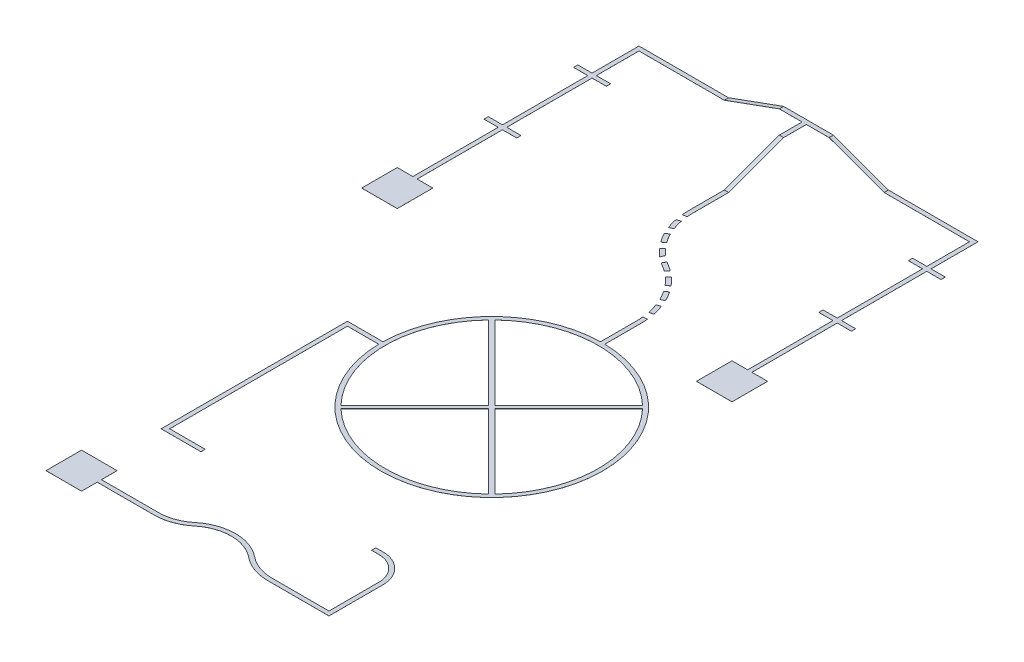
from build123d import *

# Parameters (mm, degrees)
BOSS_EXTRUDE1_DEPTH   = 0.2
BOSS_EXTRUDE3_DEPTH   = 0.2
BOSS_EXTRUDE4_DEPTH   = 0.2
SKETCH6_W             = 30
SKETCH6_H             = 412
BOSS_EXTRUDE5_DEPTH   = 0.2
BOSS_EXTRUDE6_DEPTH   = 0.2
SKETCH8_W             = 30
SKETCH8_H             = 412
BOSS_EXTRUDE7_DEPTH   = 0.2
SKETCH9_W             = 30
SKETCH9_H             = 412
BOSS_EXTRUDE8_DEPTH   = 0.2
BOSS_EXTRUDE9_DEPTH   = 0.2
BOSS_EXTRUDE9_2_DEPTH = 0.2


with BuildPart() as part:
    # Sketch2 → Boss-Extrude1 (new body)
    with BuildSketch(Plane(origin=(0, 0, 0), x_dir=(1, 0, 0), z_dir=(0, 1, 0))):
        with BuildLine():
            Line((250, 140), (650, 140))
            ThreePointArc((650, 140), (751.163325884, 157.571280681), (840.476190476, 208.226790026))
            ThreePointArc((840.476190476, 208.226790026), (1050, 283.276259054), (1259.523809524, 208.226790026))
            ThreePointArc((1259.523809524, 208.226790026), (1348.836674116, 157.571280681), (1450, 140))
            Line((1450, 140), (1850, 140))
            Line((1850, 140), (1850, 490))
            ThreePointArc((1850, 490), (1800.208152802, 610.208152802), (1680, 660))
            Line((1680, 660), (1630, 660))
            Line((1630, 660), (1630, 690))
            Line((1630, 690), (1680, 690))
            ThreePointArc((1680, 690), (1821.421356237, 631.421356237), (1880, 490))
            Line((1880, 490), (1880, 110))
            Line((1880, 110), (1850, 110))
            Line((1850, 110), (1450, 110))
            ThreePointArc((1450, 110), (1338.720341528, 129.328408749), (1240.476190476, 185.049469029))
            ThreePointArc((1240.476190476, 185.049469029), (1050, 253.276259054), (859.523809524, 185.049469029))
            ThreePointArc((859.523809524, 185.049469029), (761.279658472, 129.328408749), (650, 110))
            Line((650, 110), (250, 110))
            Line((250, 110), (250, 0))
            Line((250, 0), (0, 0))
            Line((0, 0), (0, 250))
            Line((0, 250), (250, 250))
            Line((250, 250), (250, 140))
        make_face()
    extrude(amount=BOSS_EXTRUDE1_DEPTH)


with BuildPart() as body_2:
    # Sketch3 → Boss-Extrude3 (new body)
    with BuildSketch(Plane(origin=(0, 0, 0), x_dir=(1, 0, 0), z_dir=(0, 1, 0))):
        with BuildLine():
            Line((150, 660), (430, 660))
            Line((430, 660), (430, 690))
            Line((430, 690), (180, 690))
            Line((180, 690), (180, 1940))
            Line((180, 1940), (400, 1940))
            ThreePointArc((400, 1940), (1731.399045219, 1403.456710674), (1194.855755893, 2734.855755893))
            Line((1194.855755893, 2734.855755893), (1194.855755893, 2834.855755893))
            Line((1194.855755893, 2834.855755893), (1164.855755893, 2834.855755893))
            Line((1164.855755893, 2834.855755893), (1164.855755893, 2734.855755893))
            ThreePointArc((1164.855755893, 2734.855755893), (628.312466568, 2506.543289326), (400, 1970))
            Line((400, 1970), (150, 1970))
            Line((150, 1970), (150, 660))
        make_face()
        with BuildLine():
            Line((660.238348347, 1414.169389018), (1179.855755893, 1933.786796564))
            Line((1179.855755893, 1933.786796564), (1699.47316344, 1414.169389018))
            ThreePointArc((1699.47316344, 1414.169389018), (1179.855755893, 1205), (660.238348347, 1414.169389018))
        make_face(mode=Mode.SUBTRACT)
        with BuildLine():
            ThreePointArc((639.025144911, 1435.382592454), (429.855755893, 1955), (639.025144912, 2474.617407546))
            Line((639.025144912, 2474.617407546), (1158.642552458, 1955))
            Line((1158.642552458, 1955), (639.025144911, 1435.382592454))
        make_face(mode=Mode.SUBTRACT)
        with BuildLine():
            Line((1720.686366875, 1435.382592454), (1201.068959329, 1955))
            Line((1201.068959329, 1955), (1720.686366875, 2474.617407546))
            ThreePointArc((1720.686366875, 2474.617407546), (1929.855755893, 1955), (1720.686366875, 1435.382592454))
        make_face(mode=Mode.SUBTRACT)
        with BuildLine():
            Line((1699.47316344, 2495.830610982), (1179.855755893, 1976.213203436))
            Line((1179.855755893, 1976.213203436), (660.238348347, 2495.830610982))
            ThreePointArc((660.238348347, 2495.830610982), (1179.855755893, 2705), (1699.47316344, 2495.830610982))
        make_face(mode=Mode.SUBTRACT)
    extrude(amount=BOSS_EXTRUDE3_DEPTH)

    # Sketch5 → Boss-Extrude4 (add)
    with BuildSketch(Plane(origin=(0, 0, 0), x_dir=(1, 0, 0), z_dir=(0, 1, 0))):
        with BuildLine():
            Line((1164.855755893, 2984.855755893), (1164.855755893, 2834.855755893))
            Line((1164.855755893, 2834.855755893), (1194.855755893, 2834.855755893))
            Line((1194.855755893, 2834.855755893), (1194.855755893, 2984.855755893))
            ThreePointArc((1194.855755893, 2984.855755893), (1194.193296338, 3011.346665194), (1192.207573721, 3037.771351265))
            Line((1192.207573721, 3037.771351265), (1162.357470825, 3034.776128885))
            ThreePointArc((1162.357470825, 3034.776128885), (1164.230794049, 3009.847179762), (1164.855755893, 2984.855755893))
        make_face()
        with BuildLine():
            ThreePointArc((1135.098371808, 3154.773036292), (1146.287965348, 3119.848450881), (1154.887581335, 3084.197640587))
            Line((1154.887581335, 3084.197640587), (1184.289490861, 3090.158153669))
            ThreePointArc((1184.289490861, 3090.158153669), (1175.173897915, 3127.94801258), (1163.312928763, 3164.968073116))
            Line((1163.312928763, 3164.968073116), (1135.098371808, 3154.773036292))
        make_face()
        with BuildLine():
            ThreePointArc((1079.357023142, 3264.478178903), (1098.737648085, 3233.344193508), (1115.784103566, 3200.873406249))
            Line((1115.784103566, 3200.873406249), (1142.839804426, 3213.83446527))
            ThreePointArc((1142.839804426, 3213.83446527), (1124.770561616, 3248.253499765), (1104.227099176, 3281.255524283))
            Line((1104.227099177, 3281.255524283), (1079.357023142, 3264.478178903))
        make_face()
        with BuildLine():
            ThreePointArc((998.509637349, 3357.246796856), (1024.907423487, 3331.789174092), (1049.368227181, 3304.465141588))
            Line((1049.368227181, 3304.465141588), (1072.438975459, 3323.641704729))
            ThreePointArc((1072.438975459, 3323.641704729), (1046.510523542, 3352.605179184), (1018.528870237, 3379.590259314))
            Line((1018.528870237, 3379.590259314), (998.509637349, 3357.246796856))
        make_face()
        with BuildLine():
            ThreePointArc((920.48886062, 3414.566956315), (940.379550403, 3402.092665406), (959.662713002, 3388.698371327))
            Line((959.662713002, 3388.698371327), (977.351130429, 3412.928928253))
            ThreePointArc((977.351130429, 3412.928928253), (956.910978073, 3427.126879976), (935.826846904, 3440.34962834))
            ThreePointArc((935.826846904, 3440.34962834), (923.87267779, 3447.704964341), (912.143469737, 3455.413972405))
            Line((912.143469737, 3455.413972405), (898.104174057, 3428.698913118))
            ThreePointArc((898.104174057, 3428.698913118), (909.202974349, 3421.484764825), (920.48886062, 3414.566956315))
        make_face()
        with BuildLine():
            ThreePointArc((803.417062822, 3510.974907976), (829.071712395, 3484.339103665), (856.624903314, 3459.67234899))
            Line((856.624903314, 3459.67234899), (868.458164238, 3488.971267573))
            ThreePointArc((868.458164238, 3488.971267573), (845.97283128, 3509.761267365), (824.88912157, 3531.971433382))
            Line((824.88912157, 3531.971433382), (803.417062822, 3510.974907976))
        make_face()
        with BuildLine():
            Line((769.672057288, 3553.076384353), (793.142788006, 3571.831924017))
            ThreePointArc((793.142788006, 3571.831924017), (772.67906682, 3603.168580759), (754.773619134, 3636.03413847))
            Line((754.773619134, 3636.03413847), (728.779063031, 3620.930159773))
            ThreePointArc((728.779063031, 3620.930159773), (747.879540462, 3586.192075112), (769.672057288, 3553.076384353))
        make_face()
        with BuildLine():
            Line((707.565753601, 3669.764327959), (734.951097261, 3682.203281595))
            ThreePointArc((734.951097261, 3682.203281595), (723.617452548, 3717.236171955), (715.061015689, 3753.048771662))
            Line((715.061015689, 3753.048771662), (686.123132972, 3744.773663013))
            ThreePointArc((686.123132972, 3744.773663013), (695.379265726, 3706.850150997), (707.565753601, 3669.764327959))
        make_face()
        with BuildLine():
            Line((678.407079564, 3796.529937184), (708.03851724, 3801.876675528))
            ThreePointArc((708.03851724, 3801.876675528), (706.601347796, 3823.055770091), (706.121965347, 3844.278156737))
            Line((706.121965347, 3844.278156737), (706.121965347, 4094.278156737))
            Line((706.121965347, 4094.278156737), (676.121965347, 4094.278156737))
            Line((676.121965347, 4094.278156737), (676.121965347, 3844.278156737))
            ThreePointArc((676.121965347, 3844.278156737), (676.693570634, 3820.376722588), (678.407079564, 3796.529937184))
        make_face()
    extrude(amount=BOSS_EXTRUDE4_DEPTH)


with BuildPart() as boss_extrude4_piece_1:
    # of the separate pieces the step leaves, piece 1, a body of its own (boss_extrude4_pieces)
    add(body_2.part.solids().sort_by_distance((150, 0, -660))[0])


with BuildPart() as boss_extrude4_piece_2:
    # of the separate pieces the step leaves, piece 2, a body of its own (boss_extrude4_pieces)
    add(body_2.part.solids().sort_by_distance((678.407079564, 0, -3796.529937184))[0])


with BuildPart() as boss_extrude4_piece_3:
    # of the separate pieces the step leaves, piece 3, a body of its own (boss_extrude4_pieces)
    add(body_2.part.solids().sort_by_distance((728.779063031, 0, -3620.930159773))[0])


with BuildPart() as boss_extrude4_piece_4:
    # of the separate pieces the step leaves, piece 4, a body of its own (boss_extrude4_pieces)
    add(body_2.part.solids().sort_by_distance((686.123132972, 0, -3744.773663013))[0])


with BuildPart() as boss_extrude4_piece_5:
    # of the separate pieces the step leaves, piece 5, a body of its own (boss_extrude4_pieces)
    add(body_2.part.solids().sort_by_distance((898.104174057, 0, -3428.698913118))[0])


with BuildPart() as boss_extrude4_piece_6:
    # of the separate pieces the step leaves, piece 6, a body of its own (boss_extrude4_pieces)
    add(body_2.part.solids().sort_by_distance((1142.839804426, 0, -3213.83446527))[0])


with BuildPart() as boss_extrude4_piece_7:
    # of the separate pieces the step leaves, piece 7, a body of its own (boss_extrude4_pieces)
    add(body_2.part.solids().sort_by_distance((1184.289490861, 0, -3090.158153669))[0])


with BuildPart() as boss_extrude4_piece_8:
    # of the separate pieces the step leaves, piece 8, a body of its own (boss_extrude4_pieces)
    add(body_2.part.solids().sort_by_distance((1018.528870237, 0, -3379.590259314))[0])


with BuildPart() as boss_extrude4_piece_9:
    # of the separate pieces the step leaves, piece 9, a body of its own (boss_extrude4_pieces)
    add(body_2.part.solids().sort_by_distance((824.88912157, 0, -3531.971433382))[0])


with BuildPart() as body_11:
    # Sketch6 → Boss-Extrude5 (new body)
    with BuildSketch(Plane(origin=(0, -1315.699030436, -478.875284332), x_dir=(1, 0, 0), z_dir=(0, 0.9396926207859081, 0.34202014332566943))):
        with Locations((691.121965347, 4053.431375359)):
            Rectangle(SKETCH6_W, SKETCH6_H)
    extrude(amount=-BOSS_EXTRUDE5_DEPTH)

    # Sketch7 → Boss-Extrude6 (add)
    with BuildSketch(Plane(origin=(0, 141.11229905, 0), x_dir=(1, 0, 0), z_dir=(0, 1, 0))):
        Polygon((676.121965347, 4481.4315165), (676.121965347, 4641.4315165), (516.121965347, 4641.4315165), (516.121965347, 4671.4315165), (866.121965347, 4671.4315165), (866.121965347, 4641.4315165), (706.121965347, 4641.4315165), (706.121965347, 4481.4315165), align=None)
    extrude(amount=-BOSS_EXTRUDE6_DEPTH)

    # Sketch8 → Boss-Extrude7 (add)
    with BuildSketch(Plane(origin=(15.022182209, -41.273106409, 0), x_dir=(0, 0, 1), z_dir=(-0.34202014332566977, 0.939692620785908, 0))):
        with Locations((-4656.4315165, 327.259251008)):
            Rectangle(SKETCH8_W, SKETCH8_H)
    extrude(amount=-BOSS_EXTRUDE7_DEPTH)

    # Sketch9 → Boss-Extrude8 (add)
    with BuildSketch(Plane(origin=(146.669642067, 402.971529698, 0), x_dir=(0, 0, -1), z_dir=(0.34202014332566977, 0.939692620785908, 0))):
        with Locations((4656.4315165, -971.625170791)):
            Rectangle(SKETCH9_W, SKETCH9_H)
    extrude(amount=-BOSS_EXTRUDE8_DEPTH)


with BuildPart() as body_12:
    # Sketch10 → Boss-Extrude9 (new body)
    with BuildSketch(Plane(origin=(0, 0, 0), x_dir=(1, 0, 0), z_dir=(0, 1, 0))):
        Polygon((128.968605583, 4641.4315165), (-471.031394417, 4641.4315165), (-471.031394417, 4341.4315165), (-371.031394417, 4341.4315165), (-371.031394417, 4311.4315165), (-471.031394417, 4311.4315165), (-471.031394417, 3711.4315165), (-371.031394417, 3711.4315165), (-371.031394417, 3681.4315165), (-471.031394417, 3681.4315165), (-471.031394417, 3081.4315165), (-361.031394417, 3081.4315165), (-361.031394417, 2831.4315165), (-611.031394417, 2831.4315165), (-611.031394417, 3081.4315165), (-501.031394417, 3081.4315165), (-501.031394417, 3681.4315165), (-601.031394417, 3681.4315165), (-601.031394417, 3711.4315165), (-501.031394417, 3711.4315165), (-501.031394417, 4311.4315165), (-601.031394417, 4311.4315165), (-601.031394417, 4341.4315165), (-501.031394417, 4341.4315165), (-501.031394417, 4671.4315165), (128.968605583, 4671.4315165), align=None)
    extrude(amount=BOSS_EXTRUDE9_DEPTH)


with BuildPart() as body_13:
    # Sketch10 → Boss-Extrude9 2 (new body)
    with BuildSketch(Plane(origin=(0, 0, 0), x_dir=(1, 0, 0), z_dir=(0, 1, 0))):
        Polygon((1253.27532511, 4641.4315165), (1253.27532511, 4671.4315165), (1883.27532511, 4671.4315165), (1883.27532511, 4341.4315165), (1983.27532511, 4341.4315165), (1983.27532511, 4311.4315165), (1883.27532511, 4311.4315165), (1883.27532511, 3711.4315165), (1983.27532511, 3711.4315165), (1983.27532511, 3681.4315165), (1883.27532511, 3681.4315165), (1883.27532511, 3081.4315165), (1993.27532511, 3081.4315165), (1993.27532511, 2831.4315165), (1743.27532511, 2831.4315165), (1743.27532511, 3081.4315165), (1853.27532511, 3081.4315165), (1853.27532511, 3681.4315165), (1753.27532511, 3681.4315165), (1753.27532511, 3711.4315165), (1853.27532511, 3711.4315165), (1853.27532511, 4311.4315165), (1753.27532511, 4311.4315165), (1753.27532511, 4341.4315165), (1853.27532511, 4341.4315165), (1853.27532511, 4641.4315165), align=None)
    extrude(amount=BOSS_EXTRUDE9_2_DEPTH)


solid = Compound([part.part, boss_extrude4_piece_1.part, boss_extrude4_piece_2.part, boss_extrude4_piece_3.part, boss_extrude4_piece_4.part, boss_extrude4_piece_5.part, boss_extrude4_piece_6.part, boss_extrude4_piece_7.part, boss_extrude4_piece_8.part, boss_extrude4_piece_9.part, body_11.part, body_12.part, body_13.part])
